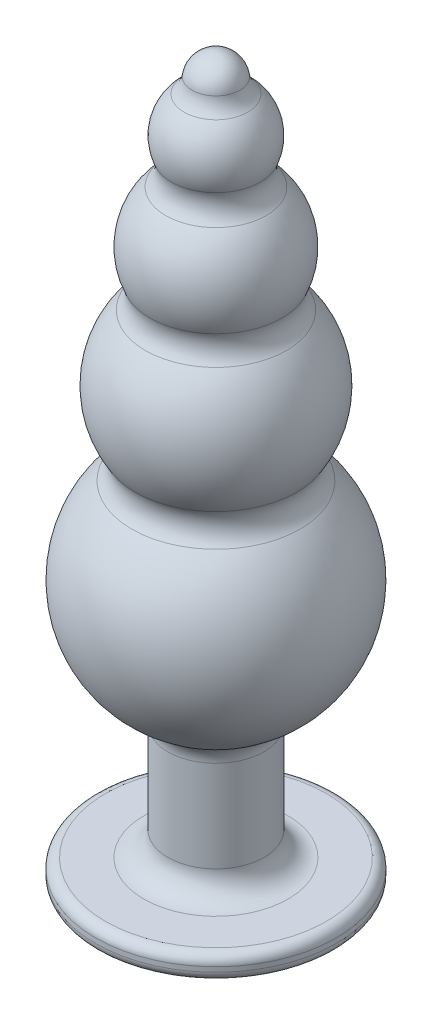
from build123d import *

# Parameters (mm, degrees)
SKETCH1_R           = 25
BOSS_EXTRUDE1_DEPTH = 5
SKETCH2_R           = 10
BOSS_EXTRUDE2_DEPTH = 50
FILLET1_R           = 5
FILLET2_R           = 2
FILLET3_R           = 5


with BuildPart() as part:
    # Sketch1 → Boss-Extrude1 (new body)
    with BuildSketch(Plane(origin=(0, 0, 0), x_dir=(1, 0, 0), z_dir=(0, 1, 0))):
        with Locations(Location((0, 0, 0), (0, 0, 270))):
            Circle(SKETCH1_R)
    extrude(amount=BOSS_EXTRUDE1_DEPTH)

    # Sketch2 → Boss-Extrude2 (add)
    with BuildSketch(Plane(origin=(0, 5, 0), x_dir=(1, 0, 0), z_dir=(0, 1, 0))):
        with Locations(Location((0, 0, 0), (0, 0, 270))):
            Circle(SKETCH2_R)
    extrude(amount=BOSS_EXTRUDE2_DEPTH)

    # Fillet1
    fillet1_edges = [part.edges().sort_by_distance(p)[0] for p in [
        (0, 5, -10),
    ]]
    fillet(fillet1_edges, radius=FILLET1_R)

    # Sketch3 → Revolve1 (revolve)
    with BuildSketch(Plane(origin=(0, 55, 0), x_dir=(1, 0, 0), z_dir=(0, 1, 0))):
        with BuildLine():
            Line((0, 25), (0, -25))
            ThreePointArc((0, -25), (25, 0), (0, 25))
        make_face()
    revolve(axis=Axis((0, 55, -25), (0, 0, 1)))

    # Fillet2
    fillet2_edges = [part.edges().sort_by_distance(p)[0] for p in [
        (0, 0, -25),
        (0, 5, -25),
    ]]
    fillet(fillet2_edges, radius=FILLET2_R)

    # Sketch4 → Revolve2 (revolve)
    with BuildSketch(Plane(origin=(0, 90, 0), x_dir=(1, 0, 0), z_dir=(0, 1, 0))):
        with BuildLine():
            Line((0, 20), (0, -20))
            ThreePointArc((0, -20), (20, 0), (0, 20))
        make_face()
    revolve(axis=Axis((0, 90, -20), (0, 0, 1)))

    # Sketch5 → Revolve3 (revolve)
    with BuildSketch(Plane(origin=(0, 115, 0), x_dir=(1, 0, 0), z_dir=(0, 1, 0))):
        with BuildLine():
            Line((0, 15), (0, -15))
            ThreePointArc((0, -15), (15, 0), (0, 15))
        make_face()
    revolve(axis=Axis((0, 115, -15), (0, 0, 1)))

    # Sketch6 → Revolve4 (revolve)
    with BuildSketch(Plane(origin=(0, 135, 0), x_dir=(1, 0, 0), z_dir=(0, 1, 0))):
        with BuildLine():
            Line((0, 10), (0, -10))
            ThreePointArc((0, -10), (10, 0), (0, 10))
        make_face()
    revolve(axis=Axis((0, 135, -10), (0, 0, 1)))

    # Sketch7 → Revolve5 (revolve)
    with BuildSketch(Plane(origin=(0, 145, 0), x_dir=(1, 0, 0), z_dir=(0, 1, 0))):
        with BuildLine():
            Line((0, 5), (0, -5))
            ThreePointArc((0, -5), (5, 0), (0, 5))
        make_face()
    revolve(axis=Axis((0, 145, -5), (0, 0, 1)))

    # Fillet3
    fillet3_edges = [part.edges().sort_by_distance(p)[0] for p in [
        (0, 32.087121525, -9.999999996),
        (0, 75.714285714, -13.997084244),
        (12, 106, 0),
        (0, 128.125, -7.261843774),
        (4.841229183, 143.75, 0),
    ]]
    fillet(fillet3_edges, radius=FILLET3_R)


solid = part.part
